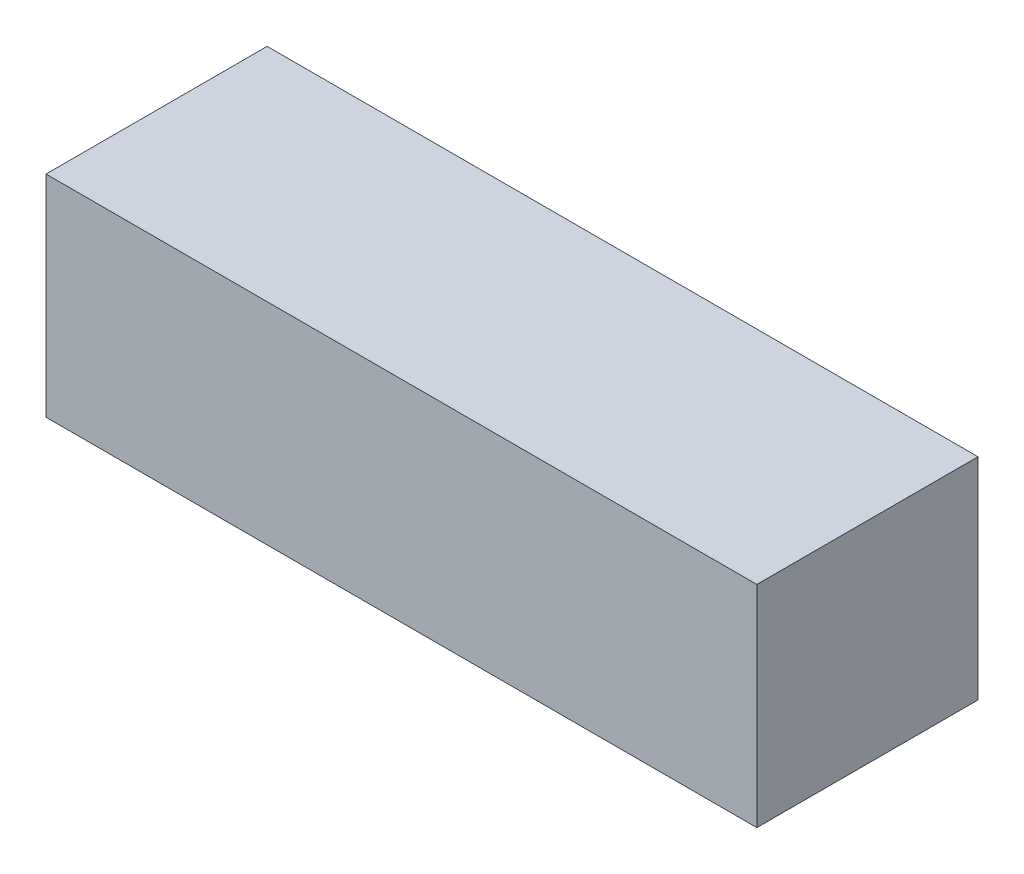
from build123d import *

# Parameters (mm, degrees)
SKETCH1_W           = 135
SKETCH1_H           = 42
BOSS_EXTRUDE1_DEPTH = 40


with BuildPart() as part:
    # Sketch1 → Boss-Extrude1 (new body)
    with BuildSketch(Plane(origin=(0, 0, 0), x_dir=(1, 0, 0), z_dir=(0, 1, 0))):
        Rectangle(SKETCH1_W, SKETCH1_H)
    extrude(amount=BOSS_EXTRUDE1_DEPTH)


solid = part.part
